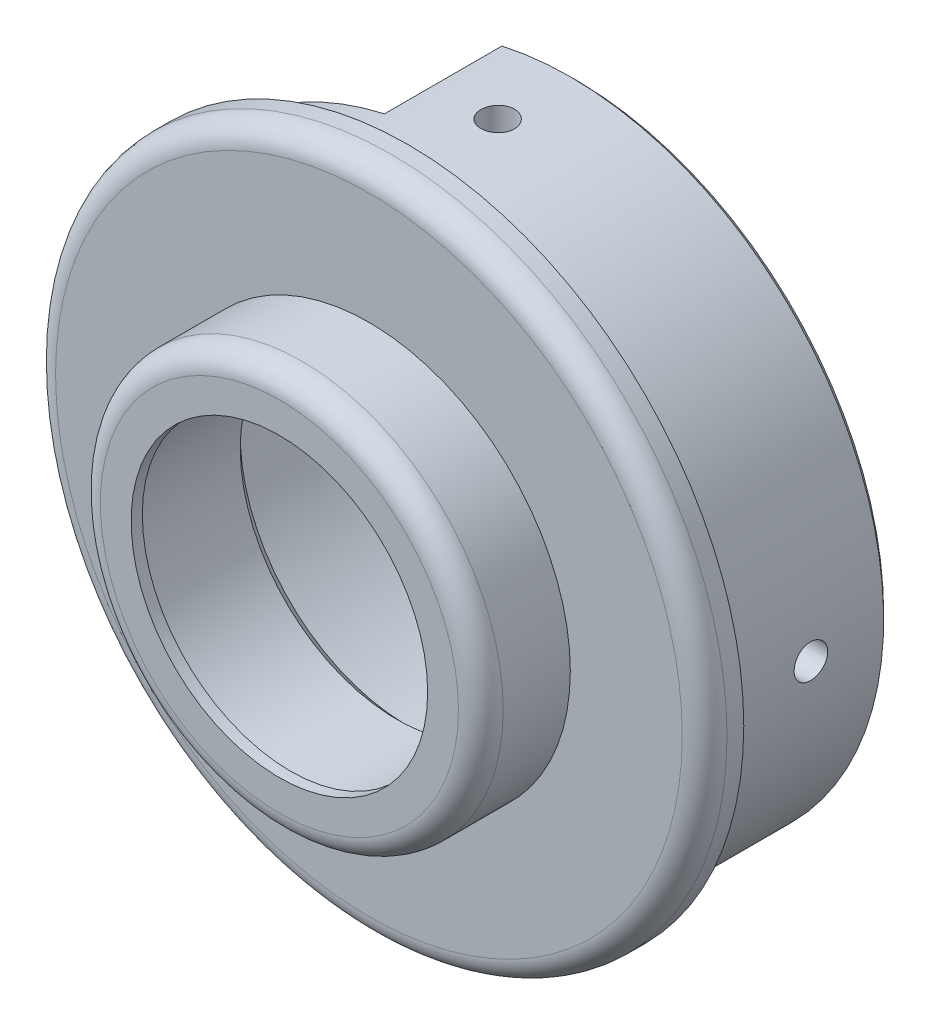
from build123d import *

# Parameters (mm, degrees)
SKETCH_2_R               = 30
SKETCH_2_R_2             = 14
EXTRUDE_1_DEPTH          = 11.5
EXTRUDE_START            = -1.5
SKETCH_3_R               = 14
SKETCH_3_R_2             = 13.25
EXTRUDE_2_DEPTH          = 1.5
SKETCH_4_R               = 33.760613234
SKETCH_4_R_2             = 18
CUT_EXTRUDE_1_DEPTH      = 8
FILLET_1_R               = 2
FILLET_2_R               = 2
SKETCH_6_R               = 28
SKETCH_6_R_2             = 23
EXTRUDE_3_DEPTH          = 15
CUT_EXTRUDE_2_DEPTH      = 46
CUT_EXTRUDE_2_DEPTH_BACK = 46
SKETCH_7_R               = 1.5
CUT_EXTRUDE_3_DEPTH      = 46.000000033
CUT_EXTRUDE_3_DEPTH_BACK = 46.000000033
SKETCH_8_R               = 1.5
CUT_EXTRUDE_4_DEPTH      = 11
SKETCH_15_R              = 14
CUT_EXTRUDE_5_DEPTH      = 0.5
CHAMFER_1_SIZE           = 1
CHAMFER_2_SIZE           = 0.5


with BuildPart() as part:
    # 스케치2 → 보스-돌출1 (new body)
    with BuildSketch(Plane.XY):
        Circle(SKETCH_2_R)
        Circle(SKETCH_2_R_2, mode=Mode.SUBTRACT)
    extrude(amount=EXTRUDE_1_DEPTH)

    # 스케치3 → 보스-돌출2 (add)
    with BuildSketch(Plane.XY.offset(11.5).offset(EXTRUDE_START)):
        Circle(SKETCH_3_R)
        Circle(SKETCH_3_R_2, mode=Mode.SUBTRACT)
    extrude(amount=EXTRUDE_2_DEPTH)

    # 스케치4 → 컷-돌출1 (cut)
    with BuildSketch(Plane.XY.offset(11.5)):
        Circle(SKETCH_4_R)
        Circle(SKETCH_4_R_2, mode=Mode.SUBTRACT)
    extrude(amount=-CUT_EXTRUDE_1_DEPTH, mode=Mode.SUBTRACT)

    # 필렛1
    fillet_1_edges = [part.edges().sort_by_distance(p)[0] for p in [
        (-18, 0, 11.5),
    ]]
    fillet(fillet_1_edges, radius=FILLET_1_R)

    # 필렛2
    fillet_2_edges = [part.edges().sort_by_distance(p)[0] for p in [
        (-30, 0, 3.5),
    ]]
    fillet(fillet_2_edges, radius=FILLET_2_R)

    # 스케치6 → 보스-돌출3 (add)
    with BuildSketch(Plane(origin=(0, 0, 0), x_dir=(-1, 0, 0), z_dir=(0, 0, -1))):
        Circle(SKETCH_6_R)
        Circle(SKETCH_6_R_2, mode=Mode.SUBTRACT)
    extrude(amount=EXTRUDE_3_DEPTH)

    # 스케치7 → 컷-돌출2 (cut, two sides: drawn at the far end of the back side and taken through both)
    with BuildSketch(Plane(origin=(0, 0, 0), x_dir=(1, 0, 0), z_dir=(0, 1, 0)).offset(-CUT_EXTRUDE_2_DEPTH_BACK)):
        with Locations(Location((0, 8, 0), (0, 0, 270))):
            Circle(SKETCH_7_R)
    extrude(amount=CUT_EXTRUDE_2_DEPTH + CUT_EXTRUDE_2_DEPTH_BACK, mode=Mode.SUBTRACT)

    # 스케치8 → 컷-돌출3 (cut, two sides: drawn at the far end of the back side and taken through both)
    with BuildSketch(Plane(origin=(0, 0, 0), x_dir=(0, 0, -1), z_dir=(1, 0, 0)).offset(-CUT_EXTRUDE_3_DEPTH_BACK)):
        with Locations((8, 0)):
            Circle(SKETCH_8_R)
    extrude(amount=CUT_EXTRUDE_3_DEPTH + CUT_EXTRUDE_3_DEPTH_BACK, mode=Mode.SUBTRACT)

    # 스케치13 → 컷-돌출4 (cut)
    with BuildSketch(Plane(origin=(0, 0, -15), x_dir=(-1, 0, 0), z_dir=(0, 0, -1))):
        Polygon((19.798989873, 19.798989873), (30.405591591, 9.192388155), (19.798989873, -1.414213562), (9.192388155, 9.192388155), (-1.414213562, 19.798989873), (9.192388155, 30.405591591), align=None)
    extrude(amount=-CUT_EXTRUDE_4_DEPTH, mode=Mode.SUBTRACT)

    # 스케치15 → 컷-돌출5 (cut)
    with BuildSketch(Plane(origin=(0, 0, 10), x_dir=(-1, 0, 0), z_dir=(0, 0, -1))):
        Circle(SKETCH_15_R)
    extrude(amount=-CUT_EXTRUDE_5_DEPTH, mode=Mode.SUBTRACT)

    # 모따기1
    chamfer_1_edges = [part.edges().sort_by_distance(p)[0] for p in [
        (-14, 0, 0),
    ]]
    chamfer(chamfer_1_edges, length=CHAMFER_1_SIZE)

    # 모따기2
    chamfer_2_edges = [part.edges().sort_by_distance(p)[0] for p in [
        (21.853217724, -17.505338474, -15),
    ]]
    chamfer(chamfer_2_edges, length=CHAMFER_2_SIZE)


solid = part.part
